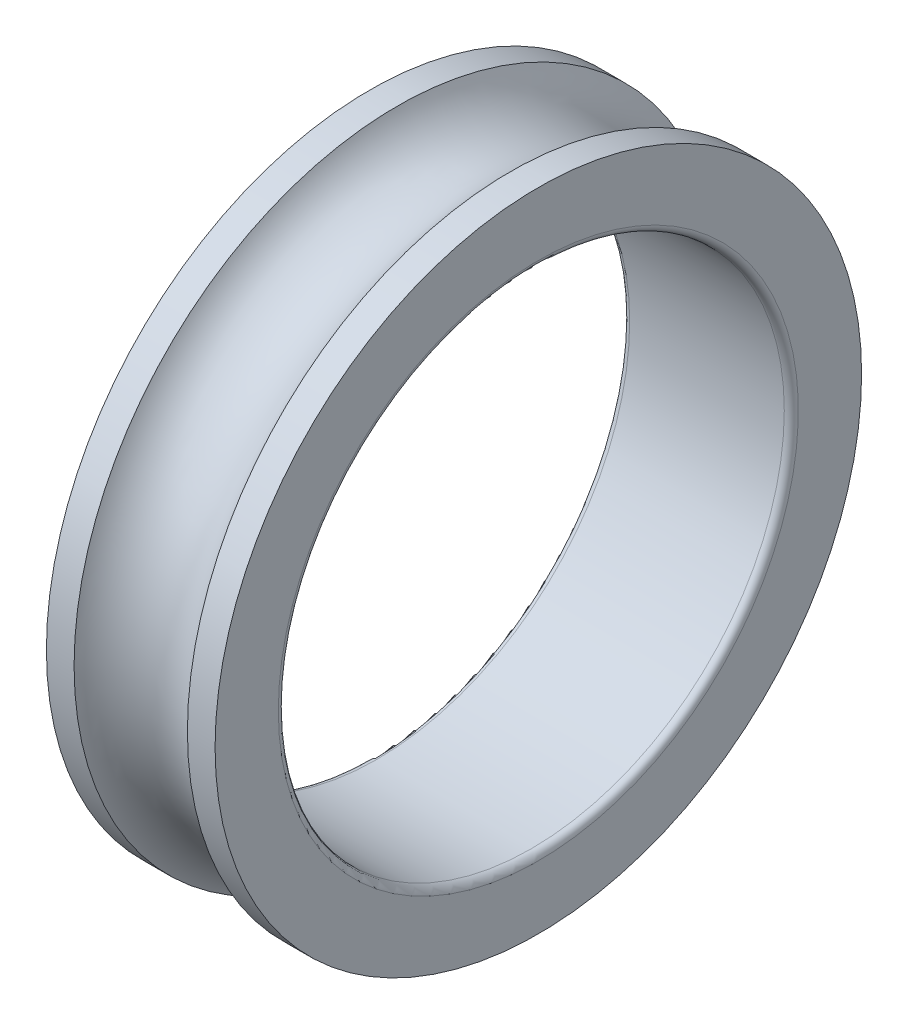
from build123d import *

# Parameters (mm, degrees)
FILLET1_R    = 5
SCALE1_SCALE = 0.277777778


with BuildPart() as part:
    # Sketch1 → Revolve1 (revolve)
    with BuildSketch(Plane.XY, mode=Mode.PRIVATE) as revolve1_sk:
        with BuildLine():
            Line((-40.311288741, 230), (-60, 230))
            Line((-60, 230), (-60, 180))
            Line((-60, 180), (60, 180))
            Line((60, 180), (60, 230))
            Line((60, 230), (40.311288741, 230))
            ThreePointArc((40.311288741, 230), (0, 205), (-40.311288741, 230))
        make_face()
    revolve(revolve1_sk.sketch.rotate(Axis((-65.903316358, 0, 0), (1, 0, 0)), 90), axis=Axis((-65.903316358, 0, 0), (1, 0, 0)))

    # Fillet1
    fillet1_edges = [part.edges().sort_by_distance(p)[0] for p in [
        (60, 0, -180),
        (-60, 0, -180),
    ]]
    fillet(fillet1_edges, radius=FILLET1_R)


with BuildPart() as part_1:
    # Scale1: scaled about (0, 0, 0)
    add(part.part.scale(SCALE1_SCALE))


solid = part_1.part
